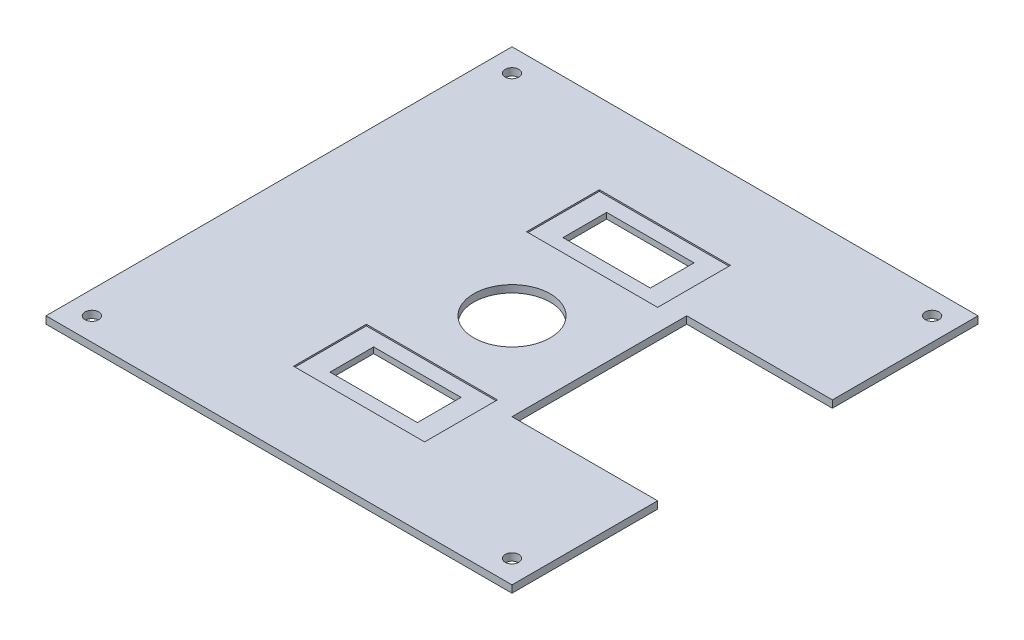
from build123d import *

# Parameters (mm, degrees)
SKETCH1_W           = 203.2
SKETCH1_H           = 203.2
SKETCH1_R           = 16.66875
BOSS_EXTRUDE1_DEPTH = 3.175
SKETCH2_W           = 63.5
SKETCH2_H           = 76.2
CUT_EXTRUDE1_DEPTH  = 3.175
SKETCH3_W           = 57.15
SKETCH3_H           = 31.75
CUT_EXTRUDE2_DEPTH  = 0.635
SKETCH4_W           = 38.1
SKETCH4_H           = 19.05
CUT_EXTRUDE3_DEPTH  = 3.175
SKETCH6_R           = 2.97688
CUT_EXTRUDE5_DEPTH  = 38.1


with BuildPart() as part:
    # Sketch1 → Boss-Extrude1 (new body)
    with BuildSketch(Plane(origin=(0, 0, 0), x_dir=(1, 0, 0), z_dir=(0, 1, 0))):
        Rectangle(SKETCH1_W, SKETCH1_H)
        with Locations(Location((0, 0, 0), (0, 0, 270))):
            Circle(SKETCH1_R, mode=Mode.SUBTRACT)
    extrude(amount=BOSS_EXTRUDE1_DEPTH)

    # Sketch2 → Cut-Extrude1 (cut)
    with BuildSketch(Plane(origin=(0, 3.175, 0), x_dir=(1, 0, 0), z_dir=(0, 1, 0))):
        with Locations((69.85, 0)):
            Rectangle(SKETCH2_W, SKETCH2_H)
    extrude(amount=-CUT_EXTRUDE1_DEPTH, mode=Mode.SUBTRACT)

    # Sketch3 → Cut-Extrude2 (cut)
    with BuildSketch(Plane(origin=(0, 3.175, 0), x_dir=(1, 0, 0), z_dir=(0, 1, 0))):
        with Locations((0, -50.8)):
            Rectangle(SKETCH3_W, SKETCH3_H)
        with Locations((0, 50.8)):
            Rectangle(SKETCH3_W, SKETCH3_H)
    extrude(amount=-CUT_EXTRUDE2_DEPTH, mode=Mode.SUBTRACT)

    # Sketch4 → Cut-Extrude3 (cut)
    with BuildSketch(Plane(origin=(0, 3.175, 0), x_dir=(1, 0, 0), z_dir=(0, 1, 0))):
        with Locations((0, -50.8)):
            Rectangle(SKETCH4_W, SKETCH4_H)
        with Locations((0, 50.8)):
            Rectangle(SKETCH4_W, SKETCH4_H)
    extrude(amount=-CUT_EXTRUDE3_DEPTH, mode=Mode.SUBTRACT)

    # Sketch6 → Cut-Extrude5 (cut)
    with BuildSketch(Plane(origin=(0, 3.175, 0), x_dir=(1, 0, 0), z_dir=(0, 1, 0))):
        with Locations(Location((-91.6, 91.6, 0), (0, 0, 270))):
            Circle(SKETCH6_R)
        with Locations(Location((91.6, 91.6, 0), (0, 0, 270))):
            Circle(SKETCH6_R)
        with Locations(Location((91.6, -91.6, 0), (0, 0, 270))):
            Circle(SKETCH6_R)
        with Locations(Location((-91.6, -91.6, 0), (0, 0, 270))):
            Circle(SKETCH6_R)
    extrude(amount=-CUT_EXTRUDE5_DEPTH, mode=Mode.SUBTRACT)


solid = part.part
